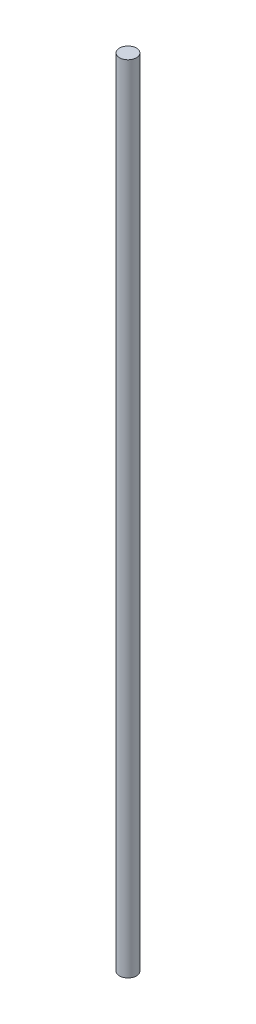
from build123d import *

# Parameters (mm, degrees)
SKETCH1_R           = 4
BOSS_EXTRUDE1_DEPTH = 377


with BuildPart() as part:
    # Sketch1 → Boss-Extrude1 (new body)
    with BuildSketch(Plane(origin=(0, 0, 0), x_dir=(1, 0, 0), z_dir=(0, 1, 0))):
        with Locations(Location((0, 0, 0), (0, 0, 270))):
            Circle(SKETCH1_R)
    extrude(amount=BOSS_EXTRUDE1_DEPTH)


solid = part.part
